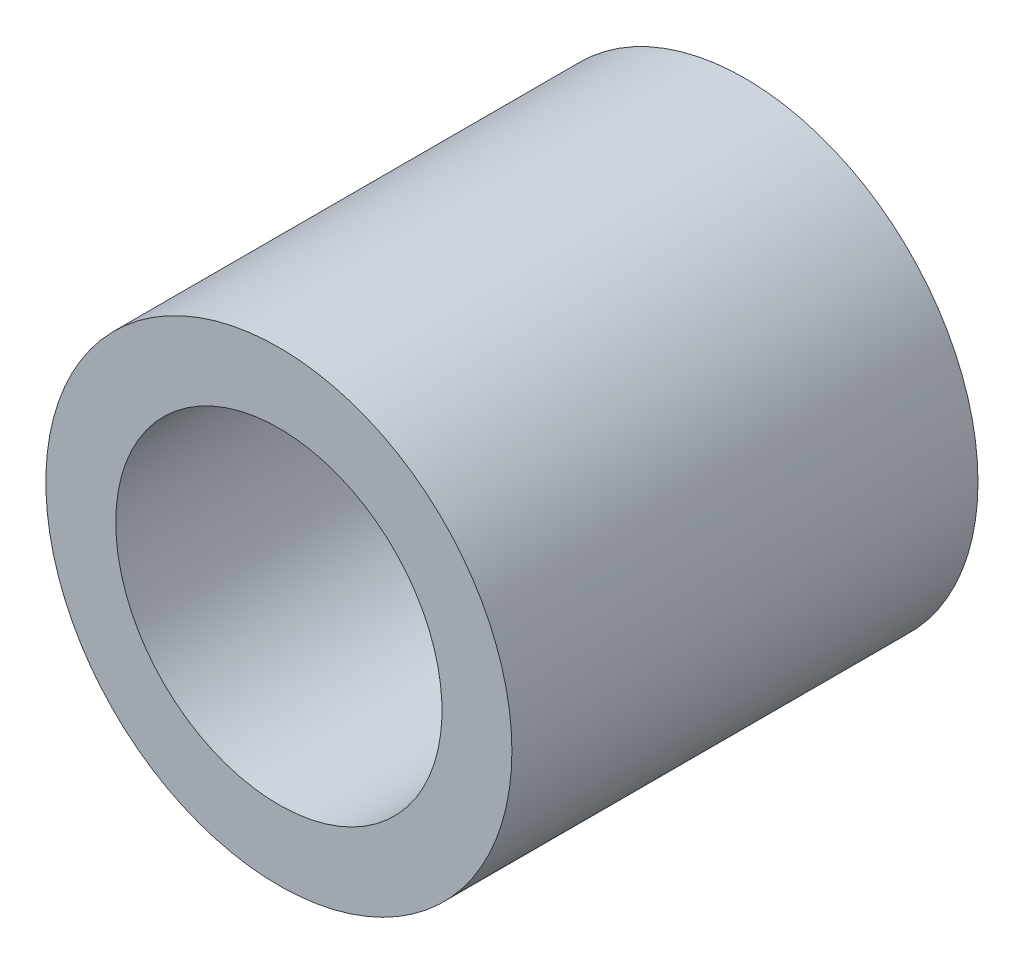
from build123d import *

# Parameters (mm, degrees)
SKETCH1_R           = 20
BOSS_EXTRUDE1_DEPTH = 40
SKETCH4_R           = 14
CUT_EXTRUDE1_DEPTH  = 40


with BuildPart() as part:
    # Sketch1 → Boss-Extrude1 (new body)
    with BuildSketch(Plane.XY):
        Circle(SKETCH1_R)
    extrude(amount=BOSS_EXTRUDE1_DEPTH)

    # Sketch4 → Cut-Extrude1 (cut)
    with BuildSketch(Plane(origin=(0, 0, 0), x_dir=(-1, 0, 0), z_dir=(0, 0, -1))):
        Circle(SKETCH4_R)
    extrude(amount=-CUT_EXTRUDE1_DEPTH, mode=Mode.SUBTRACT)


solid = part.part
